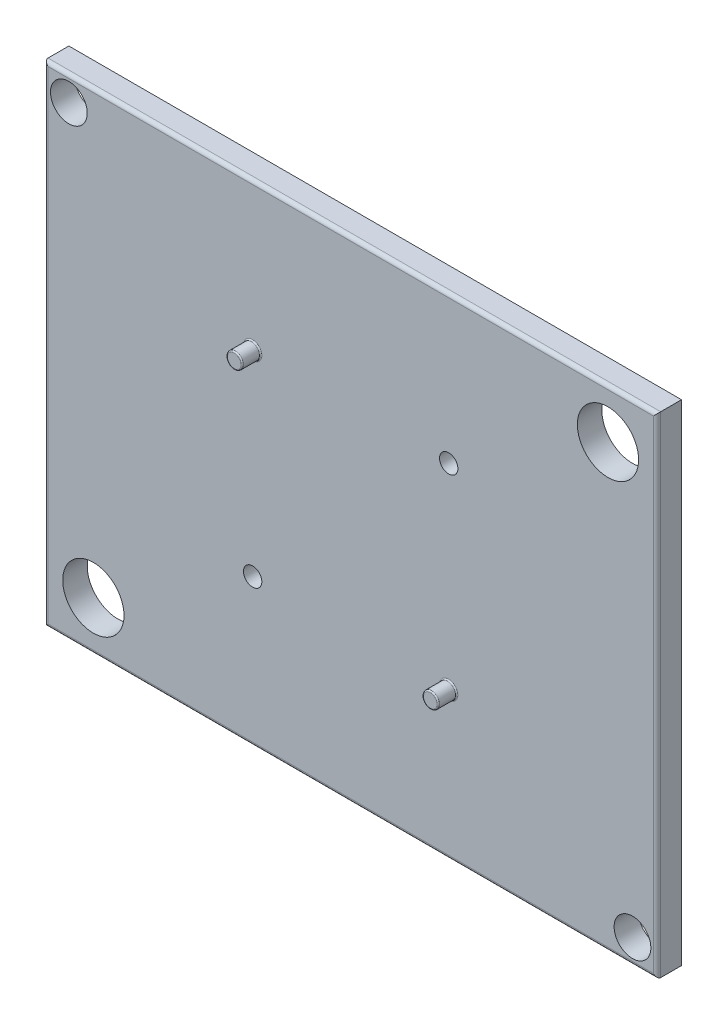
from build123d import *

# Parameters (mm, degrees)
SKETCH1_W           = 50
SKETCH1_H           = 40
SKETCH1_R           = 1.5
SKETCH1_R_2         = 0.75
SKETCH1_R_3         = 2.5
BOSS_EXTRUDE1_DEPTH = 2
FILLET1_R           = 0.3
BOSS_EXTRUDE2_START = 1
SKETCH2_R           = 0.65
BOSS_EXTRUDE2_DEPTH = 2.5
FILLET2_R           = 0.1


with BuildPart() as part:
    # Sketch1 → Boss-Extrude1 (new body)
    with BuildSketch(Plane.XY):
        Rectangle(SKETCH1_W, SKETCH1_H)
        with Locations((-23, 18)):
            Circle(SKETCH1_R, mode=Mode.SUBTRACT)
        with Locations((23, -18)):
            Circle(SKETCH1_R, mode=Mode.SUBTRACT)
        with Locations((8, 8)):
            Circle(SKETCH1_R_2, mode=Mode.SUBTRACT)
        with Locations((-8, -8)):
            Circle(SKETCH1_R_2, mode=Mode.SUBTRACT)
        with Locations((-21, -16)):
            Circle(SKETCH1_R_3, mode=Mode.SUBTRACT)
        with Locations((21, 16)):
            Circle(SKETCH1_R_3, mode=Mode.SUBTRACT)
    extrude(amount=BOSS_EXTRUDE1_DEPTH)

    # Fillet1
    fillet1_edges = [part.edges().sort_by_distance(p)[0] for p in [
        (-25, 0, 2),
        (0, -20, 2),
        (25, 0, 2),
        (0, 20, 2),
    ]]
    fillet(fillet1_edges, radius=FILLET1_R)

    # Sketch2 → Boss-Extrude2 (add)
    with BuildSketch(Plane.XY.offset(BOSS_EXTRUDE2_START)):
        with Locations((-8, 8)):
            Circle(SKETCH2_R)
        with Locations((8, -8)):
            Circle(SKETCH2_R)
    extrude(amount=BOSS_EXTRUDE2_DEPTH)

    # Fillet2
    fillet2_edges = [part.edges().sort_by_distance(p)[0] for p in [
        (-8.65, 8, 2),
        (-8.65, 8, 3.5),
        (7.35, -8, 2),
        (7.35, -8, 3.5),
    ]]
    fillet(fillet2_edges, radius=FILLET2_R)


solid = part.part
